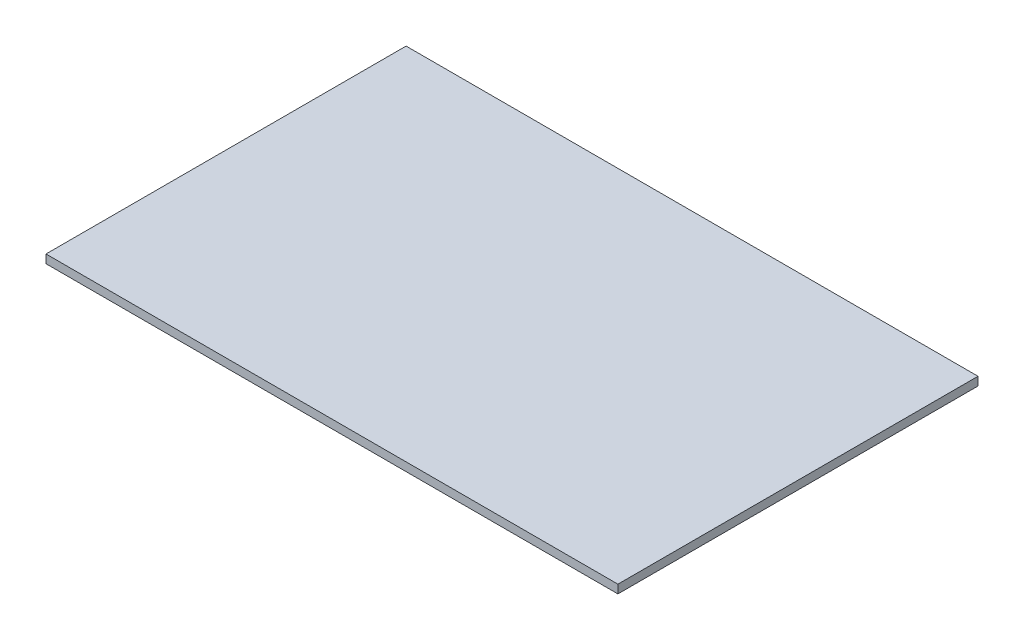
from build123d import *

# Parameters (mm, degrees)
SKETCH1_W           = 135
SKETCH1_H           = 85
BOSS_EXTRUDE1_DEPTH = 2


with BuildPart() as part:
    # Sketch1 → Boss-Extrude1 (new body)
    with BuildSketch(Plane(origin=(0, 0, 0), x_dir=(1, 0, 0), z_dir=(0, 1, 0))):
        Rectangle(SKETCH1_W, SKETCH1_H)
    extrude(amount=BOSS_EXTRUDE1_DEPTH)


solid = part.part
